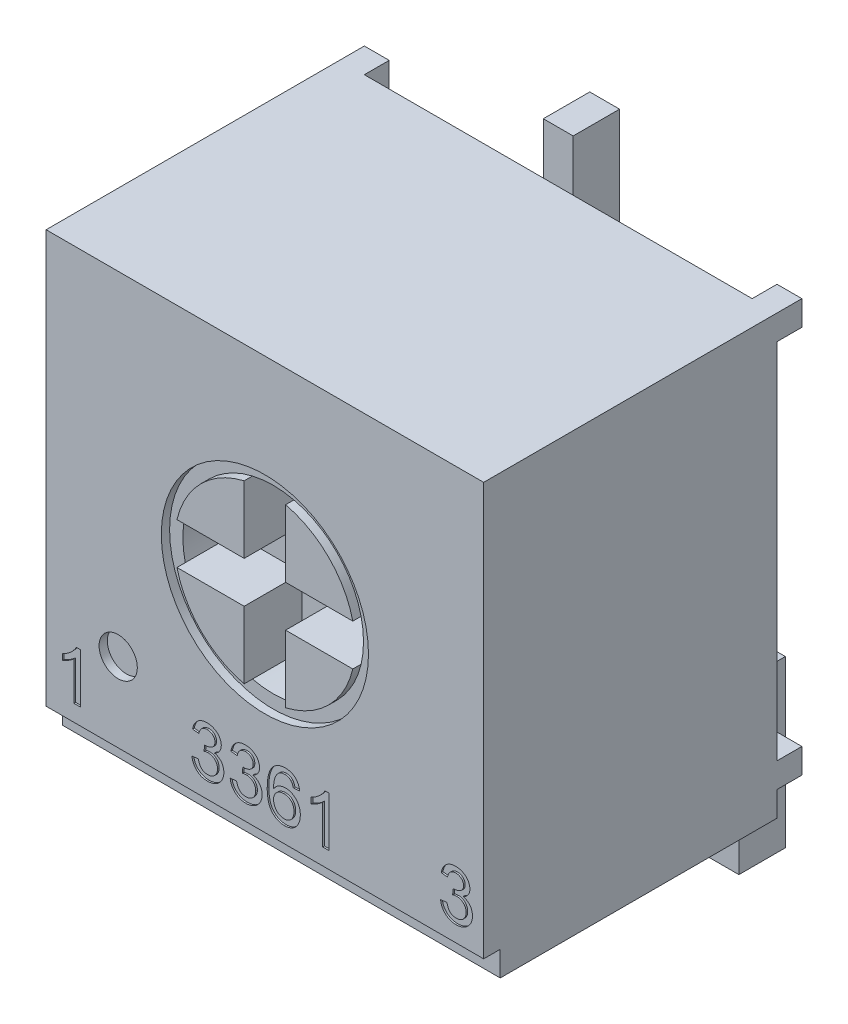
from build123d import *

# Parameters (mm, degrees)
SKETCH1_W          = 6.7056
SKETCH1_H          = 6.7056
EXTRUDE1_DEPTH     = 4.4958
SKETCH2_W          = 6.7056
SKETCH2_H          = 0.381
CUT_EXTRUDE1_DEPTH = 0.254
SKETCH3_W          = 1.27
SKETCH3_H          = 3.81
EXTRUDE2_DEPTH     = 0.3302
SKETCH4_W          = 0.381
SKETCH4_H          = 0.381
EXTRUDE3_DEPTH     = 0.381
SKETCH5_W          = 0.4572
SKETCH5_H          = 2.54
EXTRUDE4_DEPTH     = 0.7112
SKETCH6_R          = 1.5875
SKETCH6_R_2        = 1.3843
CUT_EXTRUDE2_DEPTH = 0.127
CUT_EXTRUDE3_DEPTH = 0.889
SKETCH8_R          = 0.293018345
CUT_EXTRUDE4_DEPTH = 0.127
CUT_EXTRUDE5_DEPTH = 0.0254


with BuildPart() as part:
    # Sketch1 → Extrude1 (new body)
    with BuildSketch(Plane.XY):
        with Locations((3.3528, 3.3528)):
            Rectangle(SKETCH1_W, SKETCH1_H)
    extrude(amount=EXTRUDE1_DEPTH)

    # Sketch2 → Cut-Extrude1 (cut)
    with BuildSketch(Plane.XY.offset(4.4958)):
        with Locations((3.3528, 0.1905)):
            Rectangle(SKETCH2_W, SKETCH2_H)
    extrude(amount=-CUT_EXTRUDE1_DEPTH, mode=Mode.SUBTRACT)

    # Sketch3 → Extrude2 (add)
    with BuildSketch(Plane.XZ):
        with Locations((1.651, 1.905)):
            Rectangle(SKETCH3_W, SKETCH3_H)
        with Locations((5.0546, 1.905)):
            Rectangle(SKETCH3_W, SKETCH3_H)
    extrude(amount=EXTRUDE2_DEPTH)

    # Sketch4 → Extrude3 (add)
    with BuildSketch(Plane(origin=(6.7056, 0, 0), x_dir=(0, 0, -1), z_dir=(1, 0, 0))):
        with Locations((0.1905, 6.5151)):
            Rectangle(SKETCH4_W, SKETCH4_H)
        with Locations((0.1905, 0.5715)):
            Rectangle(SKETCH4_W, SKETCH4_H)
    extrude3 = extrude(amount=-EXTRUDE3_DEPTH)

    # Mirror1: Extrude3 across plane
    add(extrude3.mirror(Plane(origin=(3.3528, 0, 0), x_dir=(0, 0, 1), z_dir=(1, 0, 0))))

    # Sketch5 → Extrude4 (add)
    with BuildSketch(Plane.XY.offset(-0.7112)):
        with Locations((3.3528, 6.223)):
            Rectangle(SKETCH5_W, SKETCH5_H)
        with Locations((0.8128, 0.2286)):
            Rectangle(SKETCH5_W, SKETCH5_H)
        with Locations((5.8928, 0.2286)):
            Rectangle(SKETCH5_W, SKETCH5_H)
    extrude(amount=EXTRUDE4_DEPTH)

    # Sketch6 → Cut-Extrude2 (cut)
    with BuildSketch(Plane.XY.offset(4.4958)):
        with Locations((3.3528, 3.5433)):
            Circle(SKETCH6_R)
        with Locations((3.3528, 3.5433)):
            Circle(SKETCH6_R_2, mode=Mode.SUBTRACT)
    extrude(amount=-CUT_EXTRUDE2_DEPTH, mode=Mode.SUBTRACT)

    # Sketch7 → Cut-Extrude3 (cut)
    with BuildSketch(Plane.XY.offset(4.4958)):
        with BuildLine():
            Line((3.0353, 4.890697581), (3.0353, 3.8608))
            Line((3.0353, 3.8608), (2.005402419, 3.8608))
            ThreePointArc((2.005402419, 3.8608), (1.9685, 3.5433), (2.005402419, 3.2258))
            Line((2.005402419, 3.2258), (3.0353, 3.2258))
            Line((3.0353, 3.2258), (3.0353, 2.195902419))
            ThreePointArc((3.0353, 2.195902419), (3.3528, 2.159), (3.6703, 2.195902419))
            Line((3.6703, 2.195902419), (3.6703, 3.2258))
            Line((3.6703, 3.2258), (4.700197581, 3.2258))
            ThreePointArc((4.700197581, 3.2258), (4.7371, 3.5433), (4.700197581, 3.8608))
            Line((4.700197581, 3.8608), (3.6703, 3.8608))
            Line((3.6703, 3.8608), (3.6703, 4.890697581))
            ThreePointArc((3.6703, 4.890697581), (3.3528, 4.9276), (3.0353, 4.890697581))
        make_face()
    extrude(amount=-CUT_EXTRUDE3_DEPTH, mode=Mode.SUBTRACT)

    # Sketch8 → Cut-Extrude4 (cut)
    with BuildSketch(Plane.XY.offset(4.4958)):
        with Locations((1.104554738, 1.59111118)):
            Circle(SKETCH8_R)
    extrude(amount=-CUT_EXTRUDE4_DEPTH, mode=Mode.SUBTRACT)

    # Sketch9 → Cut-Extrude5 (cut)
    # profile 1 of 6: a face of its own
    with BuildSketch(Plane.XY.offset(4.4958)):
        with BuildLine():
            Line((0.525601226, 0.633071844), (0.427908918, 0.633071844))
            Line((0.427908918, 0.633071844), (0.427908918, 1.226857901))
            add(Edge.make_bspline(
                [(0.427908918, 1.226857901), (0.422283787, 1.221433154), (0.410592567, 1.210158411), (0.390829795, 1.194201834), (0.368772016, 1.178029167), (0.344705663, 1.162477339), (0.320174089, 1.147836971), (0.29646748, 1.13467021), (0.273981629, 1.123527936), (0.259170078, 1.117435297), (0.252062765, 1.114511748)],
                knots=[0, 0, 0, 0, 0.893362401, 1.856755847, 2.901947673, 4.020460078, 5.132200827, 6.168787962, 7.121294059, 8, 8, 8, 8], degree=3))
            Line((0.252062765, 1.114511748), (0.252062765, 1.204571844))
            add(Edge.make_bspline(
                [(0.252062765, 1.204571844), (0.26427031, 1.210858754), (0.288330659, 1.223249882), (0.32232273, 1.244651064), (0.354057985, 1.267850825), (0.383011079, 1.292844031), (0.408965683, 1.318391574), (0.430838005, 1.344170048), (0.449139372, 1.369234526), (0.458321515, 1.38671422), (0.462711803, 1.395071844)],
                knots=[0, 0, 0, 0, 1.141258006, 2.249351951, 3.335817539, 4.406819942, 5.426913362, 6.360259544, 7.215985427, 8, 8, 8, 8], degree=3))
            Line((0.462711803, 1.395071844), (0.525601226, 1.395071844))
            Line((0.525601226, 1.395071844), (0.525601226, 0.633071844))
        make_face()
    # profile 2 of 6: a face of its own
    with BuildSketch(Plane.XY.offset(4.4958)):
        with BuildLine():
            Line((2.235216611, 0.83822569), (2.332908918, 0.847994921))
            add(Edge.make_bspline(
                [(2.332908918, 0.847994921), (2.334211274, 0.842124988), (2.336731235, 0.830767105), (2.341579948, 0.814495756), (2.346701254, 0.799392306), (2.353050107, 0.785794583), (2.359245208, 0.773146495), (2.366525389, 0.761970651), (2.374304404, 0.751975457), (2.382726061, 0.743198028), (2.391887404, 0.73563959), (2.401666292, 0.729025548), (2.412269539, 0.723501933), (2.423615966, 0.719128576), (2.435610006, 0.715588307), (2.448316843, 0.712988751), (2.461803667, 0.711440163), (2.47104779, 0.711298348), (2.475783918, 0.71122569)],
                knots=[0, 0, 0, 0, 1.321063709, 2.556160278, 3.730472002, 4.821700466, 5.852032229, 6.822994757, 7.746964065, 8.632786469, 9.490489437, 10.352773447, 11.223141997, 12.11199479, 13.021433979, 13.96892724, 14.959401504, 16, 16, 16, 16], degree=3))
            add(Edge.make_bspline(
                [(2.475783918, 0.71122569), (2.481339229, 0.711304895), (2.492188759, 0.711459583), (2.507998313, 0.713780494), (2.523043893, 0.716967327), (2.537110836, 0.721964462), (2.550395018, 0.728071885), (2.562820758, 0.735619364), (2.574473109, 0.744481993), (2.585122236, 0.754720057), (2.594645725, 0.765982254), (2.60312773, 0.777878007), (2.610141208, 0.790508822), (2.616052514, 0.803696787), (2.620415831, 0.817655016), (2.623610131, 0.832209455), (2.625697623, 0.847425926), (2.62588845, 0.857808041), (2.625985841, 0.8631067)],
                knots=[0, 0, 0, 0, 1.111377895, 2.170522867, 3.193923215, 4.186422864, 5.152846954, 6.117443035, 7.091571248, 8.078879332, 9.069127402, 10.041602243, 10.999610288, 11.957618333, 12.930786866, 13.922135183, 14.939532534, 16, 16, 16, 16], degree=3))
            add(Edge.make_bspline(
                [(2.625985841, 0.8631067), (2.625871378, 0.868149182), (2.625647439, 0.878014397), (2.623806482, 0.892494417), (2.620594053, 0.906239861), (2.616140857, 0.919330279), (2.610450588, 0.931746455), (2.603611051, 0.943591057), (2.595245737, 0.954604511), (2.585829839, 0.964905111), (2.575559841, 0.974394919), (2.564320905, 0.982467223), (2.552493321, 0.989433884), (2.539936131, 0.99505919), (2.526701472, 0.999524027), (2.512801962, 1.002732994), (2.498170774, 1.00457475), (2.488204191, 1.004798728), (2.483110841, 1.00491319)],
                knots=[0, 0, 0, 0, 1.072815875, 2.098878726, 3.09954706, 4.07199174, 5.036203424, 6.001873089, 6.97636515, 7.972747947, 8.969130744, 9.945905975, 10.911575641, 11.885646534, 12.868345115, 13.879560892, 14.916365174, 16, 16, 16, 16], degree=3))
            add(Edge.make_bspline(
                [(2.483110841, 1.00491319), (2.478626457, 1.004794384), (2.469109547, 1.004542252), (2.454088679, 1.002316013), (2.437450523, 0.999198758), (2.425953082, 0.996139634), (2.41991613, 0.994533382)],
                knots=[0, 0, 0, 0, 0.837610211, 1.777604146, 2.833088267, 4, 4, 4, 4], degree=3))
            Line((2.41991613, 0.994533382), (2.429990649, 1.082456459))
            add(Edge.make_bspline(
                [(2.429990649, 1.082456459), (2.432633967, 1.082167617), (2.437303801, 1.081657331), (2.441997184, 1.081469473), (2.444033918, 1.08138795)],
                knots=[0, 0, 0, 0, 1.132082448, 2, 2, 2, 2], degree=3))
            add(Edge.make_bspline(
                [(2.444033918, 1.08138795), (2.453018376, 1.081730973), (2.470643056, 1.082403876), (2.496336425, 1.087995141), (2.520686202, 1.096798407), (2.539497978, 1.10730198), (2.553448155, 1.117181161), (2.562244857, 1.126088644), (2.570175537, 1.135541283), (2.576092472, 1.146383803), (2.58120434, 1.157904242), (2.584369852, 1.17055642), (2.586678402, 1.184032798), (2.5868307, 1.193366903), (2.586908918, 1.198160786)],
                knots=[0, 0, 0, 0, 1.557468908, 3.055264441, 4.54122591, 6.035034992, 6.780215604, 7.498173296, 8.201377046, 8.913174237, 9.633083494, 10.382644491, 11.169345745, 12, 12, 12, 12], degree=3))
            add(Edge.make_bspline(
                [(2.586908918, 1.198160786), (2.586836729, 1.202032967), (2.586695546, 1.209605862), (2.585122706, 1.220708525), (2.582521423, 1.23122864), (2.57900553, 1.241278533), (2.574397603, 1.250805534), (2.568683412, 1.25979798), (2.562154754, 1.26843829), (2.554447905, 1.27627999), (2.546194539, 1.283642182), (2.537093688, 1.289842657), (2.527578486, 1.295350867), (2.517313352, 1.299513165), (2.50655171, 1.302935252), (2.495201566, 1.305333312), (2.483258779, 1.306943771), (2.475077111, 1.307079473), (2.470899303, 1.307148767)],
                knots=[0, 0, 0, 0, 1.041493611, 2.036867705, 3.009952345, 3.954088258, 4.897230656, 5.850851638, 6.817653571, 7.805463921, 8.805067469, 9.788883576, 10.763797054, 11.758134544, 12.762883247, 13.799594994, 14.876406454, 16, 16, 16, 16], degree=3))
            add(Edge.make_bspline(
                [(2.470899303, 1.307148767), (2.462723439, 1.306829976), (2.446934633, 1.306214345), (2.42432955, 1.300518476), (2.403845264, 1.291301818), (2.388679687, 1.280493252), (2.377910793, 1.270159652), (2.370555068, 1.261400734), (2.363975789, 1.251728334), (2.358154309, 1.2411459), (2.353169278, 1.229610873), (2.34867541, 1.217266155), (2.34519674, 1.203914107), (2.343531911, 1.194662454), (2.342678149, 1.189917998)],
                knots=[0, 0, 0, 0, 1.533565899, 2.961543033, 4.347411787, 5.731829577, 6.434842101, 7.147085226, 7.87612511, 8.629021686, 9.412189982, 10.234506416, 11.094615066, 12, 12, 12, 12], degree=3))
            Line((2.342678149, 1.189917998), (2.244985841, 1.199687228))
            add(Edge.make_bspline(
                [(2.244985841, 1.199687228), (2.246514041, 1.207240904), (2.249511724, 1.222058033), (2.255618981, 1.243458005), (2.263066705, 1.263546485), (2.27200895, 1.282231371), (2.282023255, 1.299736277), (2.293575482, 1.315853567), (2.306394789, 1.330679062), (2.320503947, 1.344167541), (2.335711415, 1.356214261), (2.351940598, 1.366606138), (2.369058309, 1.375414751), (2.387080574, 1.382516052), (2.405993125, 1.388290485), (2.425849765, 1.392116062), (2.446560618, 1.394703872), (2.460663865, 1.394947677), (2.467846418, 1.395071844)],
                knots=[0, 0, 0, 0, 1.136581168, 2.229493434, 3.279335563, 4.293305329, 5.282068175, 6.250623624, 7.213783178, 8.169396253, 9.125981663, 10.071280146, 11.007896369, 11.961295906, 12.925420184, 13.920544621, 14.940967302, 16, 16, 16, 16], degree=3))
            add(Edge.make_bspline(
                [(2.467846418, 1.395071844), (2.477788782, 1.394749437), (2.497338684, 1.394115482), (2.526052934, 1.389080533), (2.553517963, 1.380818082), (2.579512761, 1.36936485), (2.603590103, 1.355369304), (2.624896565, 1.338596494), (2.64314731, 1.319336586), (2.657987858, 1.297800147), (2.66973949, 1.274870276), (2.678435344, 1.251068075), (2.683631247, 1.226420944), (2.684277242, 1.209734843), (2.684601226, 1.201366315)],
                knots=[0, 0, 0, 0, 1.104647871, 2.172094857, 3.229560912, 4.285649672, 5.322588163, 6.317201348, 7.289435229, 8.260615662, 9.214246199, 10.146367077, 11.070353327, 12, 12, 12, 12], degree=3))
            add(Edge.make_bspline(
                [(2.684601226, 1.201366315), (2.684272771, 1.193455571), (2.683624253, 1.177836187), (2.678631429, 1.154997881), (2.670194551, 1.133361153), (2.658791058, 1.112850091), (2.644003527, 1.093908264), (2.625872573, 1.077029369), (2.604688244, 1.062051901), (2.588812381, 1.054256295), (2.580650505, 1.050248526)],
                knots=[0, 0, 0, 0, 0.975609618, 1.926294443, 2.868398979, 3.832526731, 4.812148358, 5.820404151, 6.879456693, 8, 8, 8, 8], degree=3))
            add(Edge.make_bspline(
                [(2.580650505, 1.050248526), (2.586122498, 1.048866956), (2.596840536, 1.046160864), (2.61223407, 1.040553916), (2.626705719, 1.033989592), (2.640448093, 1.026554721), (2.653062225, 1.017761782), (2.664982912, 1.008147699), (2.675759525, 0.997249453), (2.685704282, 0.985455475), (2.694752789, 0.972889193), (2.702367197, 0.959306162), (2.70893821, 0.945063458), (2.714541345, 0.930057779), (2.718567745, 0.914173419), (2.721446748, 0.897533435), (2.723346656, 0.880195639), (2.723566568, 0.868352523), (2.723678149, 0.862343478)],
                knots=[0, 0, 0, 0, 1.053251915, 2.063013066, 3.05373318, 4.018979697, 4.975584284, 5.920798056, 6.874756953, 7.832116109, 8.799604348, 9.761196922, 10.734637845, 11.72654167, 12.747371341, 13.789206138, 14.878271633, 16, 16, 16, 16], degree=3))
            add(Edge.make_bspline(
                [(2.723678149, 0.862343478), (2.723492215, 0.854139687), (2.723126795, 0.838016604), (2.719662601, 0.814331429), (2.714001332, 0.791637847), (2.706166893, 0.769858795), (2.69623942, 0.748905389), (2.683782079, 0.729073316), (2.669164077, 0.71020137), (2.652613946, 0.692470242), (2.634481694, 0.67617479), (2.614790761, 0.662064486), (2.593930733, 0.650081794), (2.571867661, 0.640309968), (2.548660035, 0.632632691), (2.524284769, 0.627129374), (2.498666433, 0.623895018), (2.481186658, 0.62350268), (2.472273101, 0.623302613)],
                knots=[0, 0, 0, 0, 1.016055063, 1.996874249, 2.958724482, 3.910019225, 4.860394196, 5.826121543, 6.806008102, 7.814207964, 8.82789325, 9.821757317, 10.810247154, 11.803791187, 12.806673825, 13.834534493, 14.895752369, 16, 16, 16, 16], degree=3))
            add(Edge.make_bspline(
                [(2.472273101, 0.623302613), (2.464273923, 0.623453285), (2.44852626, 0.623749907), (2.425474933, 0.626840203), (2.403390564, 0.631225688), (2.382447783, 0.63798644), (2.362403321, 0.646231067), (2.343596658, 0.656778824), (2.325689638, 0.668887241), (2.309018441, 0.682902258), (2.293675651, 0.698371173), (2.279988048, 0.715065187), (2.268234409, 0.732947236), (2.257871273, 0.751749769), (2.249495179, 0.771827224), (2.242973064, 0.793007222), (2.237999863, 0.815211159), (2.236154456, 0.83047071), (2.235216611, 0.83822569)],
                knots=[0, 0, 0, 0, 1.08471039, 2.135426191, 3.150939737, 4.135689946, 5.116584603, 6.086901885, 7.055842759, 8.045878862, 9.036901429, 10.008421467, 10.96965771, 11.936653536, 12.917548193, 13.915472582, 14.940632654, 16, 16, 16, 16], degree=3))
        make_face()
    # profile 3 of 6: a face of its own
    with BuildSketch(Plane.XY.offset(4.4958)):
        with BuildLine():
            Line((2.821370457, 0.83822569), (2.919062765, 0.847994921))
            add(Edge.make_bspline(
                [(2.919062765, 0.847994921), (2.92036512, 0.842124988), (2.922885081, 0.830767105), (2.927733794, 0.814495756), (2.9328551, 0.799392306), (2.939203953, 0.785794583), (2.945399054, 0.773146495), (2.952679235, 0.761970651), (2.96045825, 0.751975457), (2.968879907, 0.743198028), (2.97804125, 0.73563959), (2.987820138, 0.729025548), (2.998423386, 0.723501933), (3.009769812, 0.719128576), (3.021763852, 0.715588307), (3.034470689, 0.712988751), (3.047957513, 0.711440163), (3.057201636, 0.711298348), (3.061937765, 0.71122569)],
                knots=[0, 0, 0, 0, 1.321063709, 2.556160278, 3.730472002, 4.821700466, 5.852032229, 6.822994757, 7.746964065, 8.632786469, 9.490489437, 10.352773447, 11.223141997, 12.11199479, 13.021433979, 13.96892724, 14.959401504, 16, 16, 16, 16], degree=3))
            add(Edge.make_bspline(
                [(3.061937765, 0.71122569), (3.067493075, 0.711304895), (3.078342605, 0.711459583), (3.09415216, 0.713780494), (3.109197739, 0.716967327), (3.123264683, 0.721964462), (3.136548864, 0.728071885), (3.148974604, 0.735619364), (3.160626955, 0.744481993), (3.171276083, 0.754720057), (3.180799571, 0.765982254), (3.189281576, 0.777878007), (3.196295054, 0.790508822), (3.20220636, 0.803696787), (3.206569677, 0.817655016), (3.209763977, 0.832209455), (3.211851469, 0.847425926), (3.212042296, 0.857808041), (3.212139688, 0.8631067)],
                knots=[0, 0, 0, 0, 1.111377895, 2.170522867, 3.193923215, 4.186422864, 5.152846954, 6.117443035, 7.091571248, 8.078879332, 9.069127402, 10.041602243, 10.999610288, 11.957618333, 12.930786866, 13.922135183, 14.939532534, 16, 16, 16, 16], degree=3))
            add(Edge.make_bspline(
                [(3.212139688, 0.8631067), (3.212025224, 0.868149182), (3.211801285, 0.878014397), (3.209960328, 0.892494417), (3.206747899, 0.906239861), (3.202294703, 0.919330279), (3.196604434, 0.931746455), (3.189764897, 0.943591057), (3.181399583, 0.954604511), (3.171983685, 0.964905111), (3.161713687, 0.974394919), (3.150474752, 0.982467223), (3.138647167, 0.989433884), (3.126089977, 0.99505919), (3.112855318, 0.999524027), (3.098955808, 1.002732994), (3.08432462, 1.00457475), (3.074358037, 1.004798728), (3.069264688, 1.00491319)],
                knots=[0, 0, 0, 0, 1.072815875, 2.098878726, 3.09954706, 4.07199174, 5.036203424, 6.001873089, 6.97636515, 7.972747947, 8.969130744, 9.945905975, 10.911575641, 11.885646534, 12.868345115, 13.879560892, 14.916365174, 16, 16, 16, 16], degree=3))
            add(Edge.make_bspline(
                [(3.069264688, 1.00491319), (3.064780303, 1.004794384), (3.055263393, 1.004542252), (3.040242525, 1.002316013), (3.023604369, 0.999198758), (3.012106929, 0.996139634), (3.006069976, 0.994533382)],
                knots=[0, 0, 0, 0, 0.837610211, 1.777604146, 2.833088267, 4, 4, 4, 4], degree=3))
            Line((3.006069976, 0.994533382), (3.016144495, 1.082456459))
            add(Edge.make_bspline(
                [(3.016144495, 1.082456459), (3.018787814, 1.082167617), (3.023457647, 1.081657331), (3.02815103, 1.081469473), (3.030187765, 1.08138795)],
                knots=[0, 0, 0, 0, 1.132082448, 2, 2, 2, 2], degree=3))
            add(Edge.make_bspline(
                [(3.030187765, 1.08138795), (3.039172222, 1.081730973), (3.056796903, 1.082403876), (3.082490271, 1.087995141), (3.106840048, 1.096798407), (3.125651824, 1.10730198), (3.139602002, 1.117181161), (3.148398703, 1.126088644), (3.156329383, 1.135541283), (3.162246319, 1.146383803), (3.167358186, 1.157904242), (3.170523698, 1.17055642), (3.172832249, 1.184032798), (3.172984546, 1.193366903), (3.173062765, 1.198160786)],
                knots=[0, 0, 0, 0, 1.557468908, 3.055264441, 4.54122591, 6.035034992, 6.780215604, 7.498173296, 8.201377046, 8.913174237, 9.633083494, 10.382644491, 11.169345745, 12, 12, 12, 12], degree=3))
            add(Edge.make_bspline(
                [(3.173062765, 1.198160786), (3.172990575, 1.202032967), (3.172849392, 1.209605862), (3.171276553, 1.220708525), (3.168675269, 1.23122864), (3.165159376, 1.241278533), (3.160551449, 1.250805534), (3.154837258, 1.25979798), (3.1483086, 1.26843829), (3.140601751, 1.27627999), (3.132348385, 1.283642182), (3.123247534, 1.289842657), (3.113732332, 1.295350867), (3.103467198, 1.299513165), (3.092705556, 1.302935252), (3.081355412, 1.305333312), (3.069412625, 1.306943771), (3.061230957, 1.307079473), (3.057053149, 1.307148767)],
                knots=[0, 0, 0, 0, 1.041493611, 2.036867705, 3.009952345, 3.954088258, 4.897230656, 5.850851638, 6.817653571, 7.805463921, 8.805067469, 9.788883576, 10.763797054, 11.758134544, 12.762883247, 13.799594994, 14.876406454, 16, 16, 16, 16], degree=3))
            add(Edge.make_bspline(
                [(3.057053149, 1.307148767), (3.048877285, 1.306829976), (3.033088479, 1.306214345), (3.010483397, 1.300518476), (2.989999111, 1.291301818), (2.974833533, 1.280493252), (2.964064639, 1.270159652), (2.956708914, 1.261400734), (2.950129635, 1.251728334), (2.944308155, 1.2411459), (2.939323124, 1.229610873), (2.934829256, 1.217266155), (2.931350586, 1.203914107), (2.929685757, 1.194662454), (2.928831995, 1.189917998)],
                knots=[0, 0, 0, 0, 1.533565899, 2.961543033, 4.347411787, 5.731829577, 6.434842101, 7.147085226, 7.87612511, 8.629021686, 9.412189982, 10.234506416, 11.094615066, 12, 12, 12, 12], degree=3))
            Line((2.928831995, 1.189917998), (2.831139688, 1.199687228))
            add(Edge.make_bspline(
                [(2.831139688, 1.199687228), (2.832667887, 1.207240904), (2.83566557, 1.222058033), (2.841772827, 1.243458005), (2.849220551, 1.263546485), (2.858162796, 1.282231371), (2.868177101, 1.299736277), (2.879729328, 1.315853567), (2.892548635, 1.330679062), (2.906657793, 1.344167541), (2.921865261, 1.356214261), (2.938094444, 1.366606138), (2.955212155, 1.375414751), (2.97323442, 1.382516052), (2.992146971, 1.388290485), (3.012003611, 1.392116062), (3.032714464, 1.394703872), (3.046817711, 1.394947677), (3.054000265, 1.395071844)],
                knots=[0, 0, 0, 0, 1.136581168, 2.229493434, 3.279335563, 4.293305329, 5.282068175, 6.250623624, 7.213783178, 8.169396253, 9.125981663, 10.071280146, 11.007896369, 11.961295906, 12.925420184, 13.920544621, 14.940967302, 16, 16, 16, 16], degree=3))
            add(Edge.make_bspline(
                [(3.054000265, 1.395071844), (3.063942628, 1.394749437), (3.08349253, 1.394115482), (3.11220678, 1.389080533), (3.139671809, 1.380818082), (3.165666607, 1.36936485), (3.189743949, 1.355369304), (3.211050411, 1.338596494), (3.229301157, 1.319336586), (3.244141704, 1.297800147), (3.255893336, 1.274870276), (3.26458919, 1.251068075), (3.269785094, 1.226420944), (3.270431088, 1.209734843), (3.270755072, 1.201366315)],
                knots=[0, 0, 0, 0, 1.104647871, 2.172094857, 3.229560912, 4.285649672, 5.322588163, 6.317201348, 7.289435229, 8.260615662, 9.214246199, 10.146367077, 11.070353327, 12, 12, 12, 12], degree=3))
            add(Edge.make_bspline(
                [(3.270755072, 1.201366315), (3.270426617, 1.193455571), (3.269778099, 1.177836187), (3.264785276, 1.154997881), (3.256348397, 1.133361153), (3.244944904, 1.112850091), (3.230157373, 1.093908264), (3.212026419, 1.077029369), (3.19084209, 1.062051901), (3.174966227, 1.054256295), (3.166804351, 1.050248526)],
                knots=[0, 0, 0, 0, 0.975609618, 1.926294443, 2.868398979, 3.832526731, 4.812148358, 5.820404151, 6.879456693, 8, 8, 8, 8], degree=3))
            add(Edge.make_bspline(
                [(3.166804351, 1.050248526), (3.172276345, 1.048866956), (3.182994383, 1.046160864), (3.198387916, 1.040553916), (3.212859565, 1.033989592), (3.226601939, 1.026554721), (3.239216071, 1.017761782), (3.251136758, 1.008147699), (3.261913371, 0.997249453), (3.271858128, 0.985455475), (3.280906635, 0.972889193), (3.288521043, 0.959306162), (3.295092056, 0.945063458), (3.300695191, 0.930057779), (3.304721591, 0.914173419), (3.307600594, 0.897533435), (3.309500502, 0.880195639), (3.309720414, 0.868352523), (3.309831995, 0.862343478)],
                knots=[0, 0, 0, 0, 1.053251915, 2.063013066, 3.05373318, 4.018979697, 4.975584284, 5.920798056, 6.874756953, 7.832116109, 8.799604348, 9.761196922, 10.734637845, 11.72654167, 12.747371341, 13.789206138, 14.878271633, 16, 16, 16, 16], degree=3))
            add(Edge.make_bspline(
                [(3.309831995, 0.862343478), (3.309646061, 0.854139687), (3.309280641, 0.838016604), (3.305816448, 0.814331429), (3.300155178, 0.791637847), (3.292320739, 0.769858795), (3.282393266, 0.748905389), (3.269935925, 0.729073316), (3.255317923, 0.71020137), (3.238767792, 0.692470242), (3.22063554, 0.67617479), (3.200944608, 0.662064486), (3.180084579, 0.650081794), (3.158021507, 0.640309968), (3.134813882, 0.632632691), (3.110438615, 0.627129374), (3.084820279, 0.623895018), (3.067340504, 0.62350268), (3.058426947, 0.623302613)],
                knots=[0, 0, 0, 0, 1.016055063, 1.996874249, 2.958724482, 3.910019225, 4.860394196, 5.826121543, 6.806008102, 7.814207964, 8.82789325, 9.821757317, 10.810247154, 11.803791187, 12.806673825, 13.834534493, 14.895752369, 16, 16, 16, 16], degree=3))
            add(Edge.make_bspline(
                [(3.058426947, 0.623302613), (3.050427769, 0.623453285), (3.034680106, 0.623749907), (3.01162878, 0.626840203), (2.98954441, 0.631225688), (2.968601629, 0.63798644), (2.948557167, 0.646231067), (2.929750504, 0.656778824), (2.911843484, 0.668887241), (2.895172287, 0.682902258), (2.879829497, 0.698371173), (2.866141894, 0.715065187), (2.854388255, 0.732947236), (2.844025119, 0.751749769), (2.835649025, 0.771827224), (2.82912691, 0.793007222), (2.824153709, 0.815211159), (2.822308302, 0.83047071), (2.821370457, 0.83822569)],
                knots=[0, 0, 0, 0, 1.08471039, 2.135426191, 3.150939737, 4.135689946, 5.116584603, 6.086901885, 7.055842759, 8.045878862, 9.036901429, 10.008421467, 10.96965771, 11.936653536, 12.917548193, 13.915472582, 14.940632654, 16, 16, 16, 16], degree=3))
        make_face()
    # profile 4 of 6: a face of its own
    with BuildSketch(Plane.XY.offset(4.4958)):
        with BuildLine():
            Line((3.886216611, 1.199687228), (3.788524303, 1.189917998))
            add(Edge.make_bspline(
                [(3.788524303, 1.189917998), (3.786416182, 1.198320057), (3.782447968, 1.214135641), (3.77412666, 1.235587096), (3.764956756, 1.253731377), (3.756990103, 1.263501572), (3.753263486, 1.268071844)],
                knots=[0, 0, 0, 0, 1.199207122, 2.257322842, 3.184815751, 4, 4, 4, 4], degree=3))
            add(Edge.make_bspline(
                [(3.753263486, 1.268071844), (3.750064618, 1.27118902), (3.743773187, 1.277319785), (3.733444947, 1.28531128), (3.722557271, 1.292082076), (3.711077255, 1.297567447), (3.699066917, 1.301900576), (3.686476509, 1.30493183), (3.673334553, 1.306808348), (3.66437995, 1.307034328), (3.659845216, 1.307148767)],
                knots=[0, 0, 0, 0, 1.028360939, 2.022547923, 3.001693811, 3.976902288, 4.948369586, 5.937776631, 6.955661634, 8, 8, 8, 8], degree=3))
            add(Edge.make_bspline(
                [(3.659845216, 1.307148767), (3.652493632, 1.306912055), (3.637967223, 1.306444323), (3.616654385, 1.301865258), (3.595953628, 1.295011958), (3.583128744, 1.288064726), (3.576654111, 1.284557421)],
                knots=[0, 0, 0, 0, 1.010336883, 1.996381556, 2.988474728, 4, 4, 4, 4], degree=3))
            add(Edge.make_bspline(
                [(3.576654111, 1.284557421), (3.570286711, 1.279281865), (3.557215962, 1.268452412), (3.540158474, 1.248441852), (3.524904187, 1.225143583), (3.513653875, 1.203392875), (3.505736263, 1.183891453), (3.500615583, 1.16717814), (3.496240598, 1.148713369), (3.492595989, 1.12853193), (3.489777119, 1.106617451), (3.487421107, 1.082956016), (3.486118033, 1.05748763), (3.485827804, 1.03992088), (3.485678149, 1.030862709)],
                knots=[0, 0, 0, 0, 1.063306303, 2.18271343, 3.369442992, 4.644240368, 5.329284104, 6.077448525, 6.892756613, 7.771869145, 8.717113863, 9.73749892, 10.833357348, 12, 12, 12, 12], degree=3))
            add(Edge.make_bspline(
                [(3.485678149, 1.030862709), (3.491437759, 1.038954788), (3.502712546, 1.054795526), (3.522602122, 1.075516388), (3.544320621, 1.093032091), (3.567892324, 1.107017207), (3.592702173, 1.117856018), (3.618203079, 1.125655518), (3.64435035, 1.130443058), (3.661962296, 1.131014638), (3.670835601, 1.131302613)],
                knots=[0, 0, 0, 0, 1.083917396, 2.121834425, 3.126226247, 4.123362703, 5.106535049, 6.077135049, 7.031216202, 8, 8, 8, 8], degree=3))
            add(Edge.make_bspline(
                [(3.670835601, 1.131302613), (3.678477691, 1.131097001), (3.693576094, 1.130690775), (3.715810201, 1.127471623), (3.737126157, 1.121841103), (3.757708684, 1.114506059), (3.777162255, 1.104490812), (3.795961646, 1.092785936), (3.813671462, 1.078542446), (3.83051584, 1.06253826), (3.845851991, 1.044745166), (3.859425573, 1.02559473), (3.870736922, 1.00504105), (3.879909118, 0.983221776), (3.887087964, 0.960216306), (3.892304249, 0.935959309), (3.895357792, 0.910402842), (3.895773687, 0.892931419), (3.895985841, 0.884018959)],
                knots=[0, 0, 0, 0, 0.981553735, 1.939246043, 2.877808487, 3.810434071, 4.740031046, 5.683044261, 6.650811044, 7.654063953, 8.664382933, 9.663624521, 10.66421212, 11.671863278, 12.699354266, 13.755775259, 14.855184124, 16, 16, 16, 16], degree=3))
            add(Edge.make_bspline(
                [(3.895985841, 0.884018959), (3.895605736, 0.872240455), (3.894855606, 0.848995861), (3.88883464, 0.814765089), (3.879132748, 0.781769933), (3.86752683, 0.75564063), (3.856864021, 0.735622792), (3.847810049, 0.721621428), (3.838128799, 0.708463672), (3.828003651, 0.695968466), (3.816700221, 0.684707691), (3.804903787, 0.674150748), (3.792224432, 0.664662617), (3.77903507, 0.655927599), (3.765086545, 0.648353447), (3.750784721, 0.641622995), (3.736011869, 0.635889887), (3.720720286, 0.63138843), (3.70498829, 0.627664283), (3.688763518, 0.625103588), (3.672088669, 0.623524343), (3.660815531, 0.623377095), (3.655113245, 0.623302613)],
                knots=[0, 0, 0, 0, 1.777979151, 3.508799182, 5.232661887, 6.960203328, 7.816385973, 8.656273476, 9.47551652, 10.283326439, 11.082130802, 11.882412381, 12.672407567, 13.471692325, 14.269609044, 15.067192643, 15.857822979, 16.66013129, 17.472860815, 18.297850482, 19.139002666, 20, 20, 20, 20], degree=3))
            add(Edge.make_bspline(
                [(3.655113245, 0.623302613), (3.645483152, 0.623569661), (3.626596846, 0.624093388), (3.598953974, 0.628116899), (3.572705858, 0.63484075), (3.547796664, 0.644241455), (3.524150511, 0.656109652), (3.502000427, 0.670987255), (3.481223848, 0.688433121), (3.461804759, 0.708548428), (3.444197487, 0.731775557), (3.429149519, 0.758586792), (3.416327315, 0.788747441), (3.405833457, 0.822340485), (3.397892636, 0.859401056), (3.392174909, 0.899849558), (3.388658571, 0.943691784), (3.388215327, 0.974072219), (3.387985841, 0.989801411)],
                knots=[0, 0, 0, 0, 0.898506621, 1.76212948, 2.600594211, 3.422599815, 4.24233914, 5.064166416, 5.906856258, 6.769969817, 7.668413694, 8.619051846, 9.63165591, 10.722000005, 11.898403521, 13.164960021, 14.532183992, 16, 16, 16, 16], degree=3))
            add(Edge.make_bspline(
                [(3.387985841, 0.989801411), (3.388023893, 0.99875812), (3.388098945, 1.016423812), (3.389304954, 1.042423308), (3.390688396, 1.067532106), (3.393058705, 1.091650033), (3.395857417, 1.114885563), (3.399613253, 1.137102056), (3.403646567, 1.158472194), (3.408550255, 1.178827724), (3.414016668, 1.198360139), (3.420308699, 1.21685482), (3.426954643, 1.234551055), (3.434494327, 1.251169688), (3.442529875, 1.266981378), (3.451411997, 1.281693525), (3.460726929, 1.295642529), (3.467603599, 1.304243922), (3.471024303, 1.308522565)],
                knots=[0, 0, 0, 0, 1.28053818, 2.525659045, 3.721026795, 4.875695215, 5.990149104, 7.066600796, 8.096771069, 9.099076143, 10.059445332, 10.995815448, 11.891625124, 12.761078582, 13.603822678, 14.426062074, 15.217066536, 16, 16, 16, 16], degree=3))
            add(Edge.make_bspline(
                [(3.471024303, 1.308522565), (3.477178087, 1.31544436), (3.489307768, 1.329087861), (3.510057838, 1.346712033), (3.532168785, 1.361765787), (3.555993252, 1.373927918), (3.581349149, 1.383409905), (3.608252369, 1.390292987), (3.636777987, 1.3942847), (3.656270913, 1.39480521), (3.666256274, 1.395071844)],
                knots=[0, 0, 0, 0, 1.005002357, 1.980952959, 2.948226316, 3.90482984, 4.879026092, 5.883055346, 6.915583142, 8, 8, 8, 8], degree=3))
            add(Edge.make_bspline(
                [(3.666256274, 1.395071844), (3.673691484, 1.394940412), (3.688298554, 1.394682204), (3.709701638, 1.392204674), (3.730059733, 1.388063853), (3.74941818, 1.382478349), (3.767664416, 1.375043329), (3.785008798, 1.366232026), (3.801275206, 1.355632582), (3.816345882, 1.34338981), (3.830258155, 1.329850758), (3.842719184, 1.314901732), (3.853682017, 1.298729049), (3.863232385, 1.281299072), (3.871284947, 1.26269431), (3.8778965, 1.242834802), (3.882921721, 1.221725651), (3.88510309, 1.207135197), (3.886216611, 1.199687228)],
                knots=[0, 0, 0, 0, 1.095988384, 2.15315746, 3.171326302, 4.156539379, 5.119213808, 6.072133135, 7.021027441, 7.975952916, 8.930907862, 9.879001051, 10.840359051, 11.807350428, 12.805278655, 13.825435679, 14.889953203, 16, 16, 16, 16], degree=3))
        make_face()
        with BuildLine():
            add(Edge.make_bspline(
                [(3.485678149, 0.886003334), (3.485949876, 0.878354071), (3.486489764, 0.863155965), (3.490619286, 0.840596983), (3.497363087, 0.818586584), (3.506605543, 0.797369213), (3.518018274, 0.777656123), (3.531573938, 0.760188965), (3.546978297, 0.7452242), (3.564148563, 0.732729355), (3.583044433, 0.723127411), (3.603327477, 0.716173107), (3.625021929, 0.711969903), (3.639982582, 0.711477508), (3.647633678, 0.71122569)],
                knots=[0, 0, 0, 0, 1.034121613, 2.054667162, 3.090870403, 4.141799978, 5.178094622, 6.163726224, 7.122467907, 8.07367165, 9.024701118, 9.977919151, 10.965878387, 12, 12, 12, 12], degree=3))
            add(Edge.make_bspline(
                [(3.647633678, 0.71122569), (3.653085954, 0.711373147), (3.663728314, 0.711660969), (3.679310457, 0.713891302), (3.694177544, 0.717320892), (3.708243489, 0.722388088), (3.721489204, 0.728855224), (3.733983465, 0.736726152), (3.745718191, 0.746024438), (3.7565515, 0.756733015), (3.766342468, 0.768642876), (3.774849521, 0.781680938), (3.782362044, 0.79563269), (3.78801266, 0.810840991), (3.792617094, 0.82691622), (3.796002233, 0.844010373), (3.797989665, 0.862143076), (3.798190777, 0.874600876), (3.798293534, 0.880966075)],
                knots=[0, 0, 0, 0, 1.023436885, 1.997658284, 2.950132304, 3.883974581, 4.798406504, 5.712938251, 6.651509614, 7.604127386, 8.56812849, 9.540661787, 10.523651728, 11.536824179, 12.580180944, 13.661349568, 14.805088061, 16, 16, 16, 16], degree=3))
            add(Edge.make_bspline(
                [(3.798293534, 0.880966075), (3.798198229, 0.887078482), (3.798011847, 0.899032066), (3.795914671, 0.916474886), (3.792859587, 0.932964534), (3.788169679, 0.948362262), (3.78241362, 0.962831081), (3.77520134, 0.976262759), (3.766797672, 0.988771453), (3.756944716, 1.00002594), (3.746169805, 1.010279439), (3.7343361, 1.019185581), (3.721585623, 1.026707302), (3.707872375, 1.032865097), (3.693170526, 1.037584323), (3.677510518, 1.040854862), (3.660980467, 1.043137841), (3.649626233, 1.043297736), (3.643817572, 1.043379536)],
                knots=[0, 0, 0, 0, 1.155658139, 2.260035327, 3.319019312, 4.323913291, 5.299809325, 6.260058621, 7.202437855, 8.144128683, 9.083751266, 10.011616631, 10.939332216, 11.87851101, 12.849505762, 13.853846437, 14.90205895, 16, 16, 16, 16], degree=3))
            add(Edge.make_bspline(
                [(3.643817572, 1.043379536), (3.638415509, 1.043295133), (3.62777023, 1.043128808), (3.612158839, 1.040828015), (3.597112627, 1.037550922), (3.582691669, 1.032783213), (3.568891004, 1.026643312), (3.555713692, 1.019174851), (3.543274166, 1.010163881), (3.531458997, 1.000072631), (3.520677798, 0.988862645), (3.511218874, 0.976734773), (3.503503779, 0.96361099), (3.496759535, 0.949812358), (3.491818261, 0.935013602), (3.488302483, 0.919413129), (3.486122791, 0.903008059), (3.485828669, 0.891759764), (3.485678149, 0.886003334)],
                knots=[0, 0, 0, 0, 1.036988316, 2.04348404, 3.025371103, 3.992992706, 4.955812186, 5.923433788, 6.897355974, 7.902569022, 8.905116476, 9.880852345, 10.849905012, 11.825004025, 12.826645469, 13.839294292, 14.894236693, 16, 16, 16, 16], degree=3))
        make_face(mode=Mode.SUBTRACT)
    # profile 5 of 6: a face of its own
    with BuildSketch(Plane.XY.offset(4.4958)):
        with BuildLine():
            Line((4.335601226, 0.633071844), (4.237908918, 0.633071844))
            Line((4.237908918, 0.633071844), (4.237908918, 1.226857901))
            add(Edge.make_bspline(
                [(4.237908918, 1.226857901), (4.232283787, 1.221433154), (4.220592567, 1.210158411), (4.200829795, 1.194201834), (4.178772016, 1.178029167), (4.154705663, 1.162477339), (4.130174089, 1.147836971), (4.10646748, 1.13467021), (4.083981629, 1.123527936), (4.069170078, 1.117435297), (4.062062765, 1.114511748)],
                knots=[0, 0, 0, 0, 0.893362401, 1.856755847, 2.901947673, 4.020460078, 5.132200827, 6.168787962, 7.121294059, 8, 8, 8, 8], degree=3))
            Line((4.062062765, 1.114511748), (4.062062765, 1.204571844))
            add(Edge.make_bspline(
                [(4.062062765, 1.204571844), (4.07427031, 1.210858754), (4.098330659, 1.223249882), (4.13232273, 1.244651064), (4.164057985, 1.267850825), (4.193011079, 1.292844031), (4.218965683, 1.318391574), (4.240838005, 1.344170048), (4.259139372, 1.369234526), (4.268321515, 1.38671422), (4.272711803, 1.395071844)],
                knots=[0, 0, 0, 0, 1.141258006, 2.249351951, 3.335817539, 4.406819942, 5.426913362, 6.360259544, 7.215985427, 8, 8, 8, 8], degree=3))
            Line((4.272711803, 1.395071844), (4.335601226, 1.395071844))
            Line((4.335601226, 1.395071844), (4.335601226, 0.633071844))
        make_face()
    # profile 6 of 6: a face of its own
    with BuildSketch(Plane.XY.offset(4.4958)):
        with BuildLine():
            Line((6.045216611, 0.83822569), (6.142908918, 0.847994921))
            add(Edge.make_bspline(
                [(6.142908918, 0.847994921), (6.144211274, 0.842124988), (6.146731235, 0.830767105), (6.151579948, 0.814495756), (6.156701254, 0.799392306), (6.163050107, 0.785794583), (6.169245208, 0.773146495), (6.176525389, 0.761970651), (6.184304404, 0.751975457), (6.192726061, 0.743198028), (6.201887404, 0.73563959), (6.211666292, 0.729025548), (6.222269539, 0.723501933), (6.233615966, 0.719128576), (6.245610006, 0.715588307), (6.258316843, 0.712988751), (6.271803667, 0.711440163), (6.28104779, 0.711298348), (6.285783918, 0.71122569)],
                knots=[0, 0, 0, 0, 1.321063709, 2.556160278, 3.730472002, 4.821700466, 5.852032229, 6.822994757, 7.746964065, 8.632786469, 9.490489437, 10.352773447, 11.223141997, 12.11199479, 13.021433979, 13.96892724, 14.959401504, 16, 16, 16, 16], degree=3))
            add(Edge.make_bspline(
                [(6.285783918, 0.71122569), (6.291339229, 0.711304895), (6.302188759, 0.711459583), (6.317998313, 0.713780494), (6.333043893, 0.716967327), (6.347110836, 0.721964462), (6.360395018, 0.728071885), (6.372820758, 0.735619364), (6.384473109, 0.744481993), (6.395122236, 0.754720057), (6.404645725, 0.765982254), (6.41312773, 0.777878007), (6.420141208, 0.790508822), (6.426052514, 0.803696787), (6.430415831, 0.817655016), (6.433610131, 0.832209455), (6.435697623, 0.847425926), (6.43588845, 0.857808041), (6.435985841, 0.8631067)],
                knots=[0, 0, 0, 0, 1.111377895, 2.170522867, 3.193923215, 4.186422864, 5.152846954, 6.117443035, 7.091571248, 8.078879332, 9.069127402, 10.041602243, 10.999610288, 11.957618333, 12.930786866, 13.922135183, 14.939532534, 16, 16, 16, 16], degree=3))
            add(Edge.make_bspline(
                [(6.435985841, 0.8631067), (6.435871378, 0.868149182), (6.435647439, 0.878014397), (6.433806482, 0.892494417), (6.430594053, 0.906239861), (6.426140857, 0.919330279), (6.420450588, 0.931746455), (6.413611051, 0.943591057), (6.405245737, 0.954604511), (6.395829839, 0.964905111), (6.385559841, 0.974394919), (6.374320905, 0.982467223), (6.362493321, 0.989433884), (6.349936131, 0.99505919), (6.336701472, 0.999524027), (6.322801962, 1.002732994), (6.308170774, 1.00457475), (6.298204191, 1.004798728), (6.293110841, 1.00491319)],
                knots=[0, 0, 0, 0, 1.072815875, 2.098878726, 3.09954706, 4.07199174, 5.036203424, 6.001873089, 6.97636515, 7.972747947, 8.969130744, 9.945905975, 10.911575641, 11.885646534, 12.868345115, 13.879560892, 14.916365174, 16, 16, 16, 16], degree=3))
            add(Edge.make_bspline(
                [(6.293110841, 1.00491319), (6.288626457, 1.004794384), (6.279109547, 1.004542252), (6.264088679, 1.002316013), (6.247450523, 0.999198758), (6.235953082, 0.996139634), (6.22991613, 0.994533382)],
                knots=[0, 0, 0, 0, 0.837610211, 1.777604146, 2.833088267, 4, 4, 4, 4], degree=3))
            Line((6.22991613, 0.994533382), (6.239990649, 1.082456459))
            add(Edge.make_bspline(
                [(6.239990649, 1.082456459), (6.242633967, 1.082167617), (6.247303801, 1.081657331), (6.251997184, 1.081469473), (6.254033918, 1.08138795)],
                knots=[0, 0, 0, 0, 1.132082448, 2, 2, 2, 2], degree=3))
            add(Edge.make_bspline(
                [(6.254033918, 1.08138795), (6.263018376, 1.081730973), (6.280643056, 1.082403876), (6.306336425, 1.087995141), (6.330686202, 1.096798407), (6.349497978, 1.10730198), (6.363448155, 1.117181161), (6.372244857, 1.126088644), (6.380175537, 1.135541283), (6.386092472, 1.146383803), (6.39120434, 1.157904242), (6.394369852, 1.17055642), (6.396678402, 1.184032798), (6.3968307, 1.193366903), (6.396908918, 1.198160786)],
                knots=[0, 0, 0, 0, 1.557468908, 3.055264441, 4.54122591, 6.035034992, 6.780215604, 7.498173296, 8.201377046, 8.913174237, 9.633083494, 10.382644491, 11.169345745, 12, 12, 12, 12], degree=3))
            add(Edge.make_bspline(
                [(6.396908918, 1.198160786), (6.396836729, 1.202032967), (6.396695546, 1.209605862), (6.395122706, 1.220708525), (6.392521423, 1.23122864), (6.38900553, 1.241278533), (6.384397603, 1.250805534), (6.378683412, 1.25979798), (6.372154754, 1.26843829), (6.364447905, 1.27627999), (6.356194539, 1.283642182), (6.347093688, 1.289842657), (6.337578486, 1.295350867), (6.327313352, 1.299513165), (6.31655171, 1.302935252), (6.305201566, 1.305333312), (6.293258779, 1.306943771), (6.285077111, 1.307079473), (6.280899303, 1.307148767)],
                knots=[0, 0, 0, 0, 1.041493611, 2.036867705, 3.009952345, 3.954088258, 4.897230656, 5.850851638, 6.817653571, 7.805463921, 8.805067469, 9.788883576, 10.763797054, 11.758134544, 12.762883247, 13.799594994, 14.876406454, 16, 16, 16, 16], degree=3))
            add(Edge.make_bspline(
                [(6.280899303, 1.307148767), (6.272723439, 1.306829976), (6.256934633, 1.306214345), (6.23432955, 1.300518476), (6.213845264, 1.291301818), (6.198679687, 1.280493252), (6.187910793, 1.270159652), (6.180555068, 1.261400734), (6.173975789, 1.251728334), (6.168154309, 1.2411459), (6.163169278, 1.229610873), (6.15867541, 1.217266155), (6.15519674, 1.203914107), (6.153531911, 1.194662454), (6.152678149, 1.189917998)],
                knots=[0, 0, 0, 0, 1.533565899, 2.961543033, 4.347411787, 5.731829577, 6.434842101, 7.147085226, 7.87612511, 8.629021686, 9.412189982, 10.234506416, 11.094615066, 12, 12, 12, 12], degree=3))
            Line((6.152678149, 1.189917998), (6.054985841, 1.199687228))
            add(Edge.make_bspline(
                [(6.054985841, 1.199687228), (6.056514041, 1.207240904), (6.059511724, 1.222058033), (6.065618981, 1.243458005), (6.073066705, 1.263546485), (6.08200895, 1.282231371), (6.092023255, 1.299736277), (6.103575482, 1.315853567), (6.116394789, 1.330679062), (6.130503947, 1.344167541), (6.145711415, 1.356214261), (6.161940598, 1.366606138), (6.179058309, 1.375414751), (6.197080574, 1.382516052), (6.215993125, 1.388290485), (6.235849765, 1.392116062), (6.256560618, 1.394703872), (6.270663865, 1.394947677), (6.277846418, 1.395071844)],
                knots=[0, 0, 0, 0, 1.136581168, 2.229493434, 3.279335563, 4.293305329, 5.282068175, 6.250623624, 7.213783178, 8.169396253, 9.125981663, 10.071280146, 11.007896369, 11.961295906, 12.925420184, 13.920544621, 14.940967302, 16, 16, 16, 16], degree=3))
            add(Edge.make_bspline(
                [(6.277846418, 1.395071844), (6.287788782, 1.394749437), (6.307338684, 1.394115482), (6.336052934, 1.389080533), (6.363517963, 1.380818082), (6.389512761, 1.36936485), (6.413590103, 1.355369304), (6.434896565, 1.338596494), (6.45314731, 1.319336586), (6.467987858, 1.297800147), (6.47973949, 1.274870276), (6.488435344, 1.251068075), (6.493631247, 1.226420944), (6.494277242, 1.209734843), (6.494601226, 1.201366315)],
                knots=[0, 0, 0, 0, 1.104647871, 2.172094857, 3.229560912, 4.285649672, 5.322588163, 6.317201348, 7.289435229, 8.260615662, 9.214246199, 10.146367077, 11.070353327, 12, 12, 12, 12], degree=3))
            add(Edge.make_bspline(
                [(6.494601226, 1.201366315), (6.494272771, 1.193455571), (6.493624253, 1.177836187), (6.488631429, 1.154997881), (6.480194551, 1.133361153), (6.468791058, 1.112850091), (6.454003527, 1.093908264), (6.435872573, 1.077029369), (6.414688244, 1.062051901), (6.398812381, 1.054256295), (6.390650505, 1.050248526)],
                knots=[0, 0, 0, 0, 0.975609618, 1.926294443, 2.868398979, 3.832526731, 4.812148358, 5.820404151, 6.879456693, 8, 8, 8, 8], degree=3))
            add(Edge.make_bspline(
                [(6.390650505, 1.050248526), (6.396122498, 1.048866956), (6.406840536, 1.046160864), (6.42223407, 1.040553916), (6.436705719, 1.033989592), (6.450448093, 1.026554721), (6.463062225, 1.017761782), (6.474982912, 1.008147699), (6.485759525, 0.997249453), (6.495704282, 0.985455475), (6.504752789, 0.972889193), (6.512367197, 0.959306162), (6.51893821, 0.945063458), (6.524541345, 0.930057779), (6.528567745, 0.914173419), (6.531446748, 0.897533435), (6.533346656, 0.880195639), (6.533566568, 0.868352523), (6.533678149, 0.862343478)],
                knots=[0, 0, 0, 0, 1.053251915, 2.063013066, 3.05373318, 4.018979697, 4.975584284, 5.920798056, 6.874756953, 7.832116109, 8.799604348, 9.761196922, 10.734637845, 11.72654167, 12.747371341, 13.789206138, 14.878271633, 16, 16, 16, 16], degree=3))
            add(Edge.make_bspline(
                [(6.533678149, 0.862343478), (6.533492215, 0.854139687), (6.533126795, 0.838016604), (6.529662601, 0.814331429), (6.524001332, 0.791637847), (6.516166893, 0.769858795), (6.50623942, 0.748905389), (6.493782079, 0.729073316), (6.479164077, 0.71020137), (6.462613946, 0.692470242), (6.444481694, 0.67617479), (6.424790761, 0.662064486), (6.403930733, 0.650081794), (6.381867661, 0.640309968), (6.358660035, 0.632632691), (6.334284769, 0.627129374), (6.308666433, 0.623895018), (6.291186658, 0.62350268), (6.282273101, 0.623302613)],
                knots=[0, 0, 0, 0, 1.016055063, 1.996874249, 2.958724482, 3.910019225, 4.860394196, 5.826121543, 6.806008102, 7.814207964, 8.82789325, 9.821757317, 10.810247154, 11.803791187, 12.806673825, 13.834534493, 14.895752369, 16, 16, 16, 16], degree=3))
            add(Edge.make_bspline(
                [(6.282273101, 0.623302613), (6.274273923, 0.623453285), (6.25852626, 0.623749907), (6.235474933, 0.626840203), (6.213390564, 0.631225688), (6.192447783, 0.63798644), (6.172403321, 0.646231067), (6.153596658, 0.656778824), (6.135689638, 0.668887241), (6.119018441, 0.682902258), (6.103675651, 0.698371173), (6.089988048, 0.715065187), (6.078234409, 0.732947236), (6.067871273, 0.751749769), (6.059495179, 0.771827224), (6.052973064, 0.793007222), (6.047999863, 0.815211159), (6.046154456, 0.83047071), (6.045216611, 0.83822569)],
                knots=[0, 0, 0, 0, 1.08471039, 2.135426191, 3.150939737, 4.135689946, 5.116584603, 6.086901885, 7.055842759, 8.045878862, 9.036901429, 10.008421467, 10.96965771, 11.936653536, 12.917548193, 13.915472582, 14.940632654, 16, 16, 16, 16], degree=3))
        make_face()
    extrude(amount=-CUT_EXTRUDE5_DEPTH, mode=Mode.SUBTRACT)


solid = part.part
